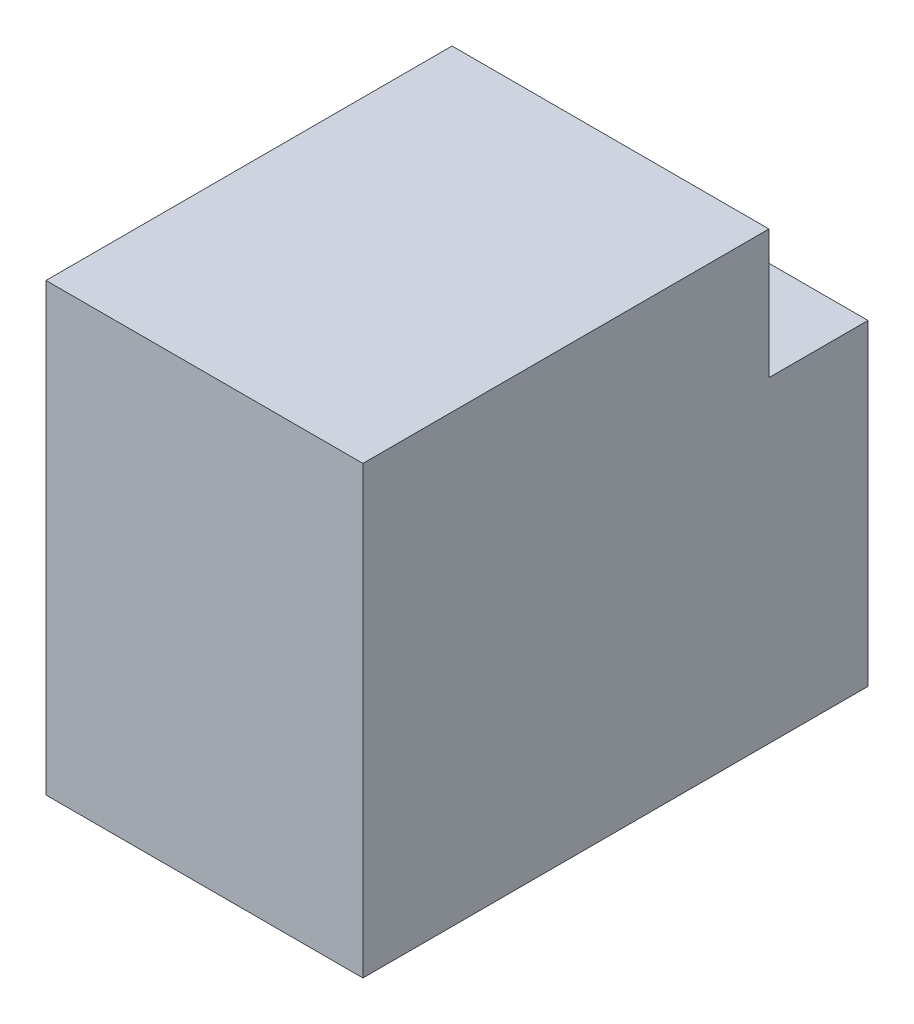
from build123d import *

# Parameters (mm, degrees)
SKETCH1_W           = 32
SKETCH1_H           = 32
BOSS_EXTRUDE1_DEPTH = 10
SKETCH2_W           = 32
SKETCH2_H           = 45
BOSS_EXTRUDE2_DEPTH = 41
SKETCH3_R           = 1.6
SKETCH3_R_2         = 6.5
CUT_EXTRUDE1_DEPTH  = 10


with BuildPart() as part:
    # Sketch1 → Boss-Extrude1 (new body)
    with BuildSketch(Plane.XY):
        Rectangle(SKETCH1_W, SKETCH1_H)
    extrude(amount=BOSS_EXTRUDE1_DEPTH)

    # Sketch2 → Boss-Extrude2 (add)
    with BuildSketch(Plane.XY.offset(10)):
        with Locations((0, 6.5)):
            Rectangle(SKETCH2_W, SKETCH2_H)
    extrude(amount=BOSS_EXTRUDE2_DEPTH)

    # Sketch3 → Cut-Extrude1 (cut)
    with BuildSketch(Plane(origin=(0, 0, 0), x_dir=(-1, 0, 0), z_dir=(0, 0, -1))):
        with Locations((-12, 12)):
            Circle(SKETCH3_R)
        with Locations((-12, -12)):
            Circle(SKETCH3_R)
        with Locations((12, 12)):
            Circle(SKETCH3_R)
        with Locations((12, -12)):
            Circle(SKETCH3_R)
        Circle(SKETCH3_R_2)
    extrude(amount=-CUT_EXTRUDE1_DEPTH, mode=Mode.SUBTRACT)


solid = part.part
